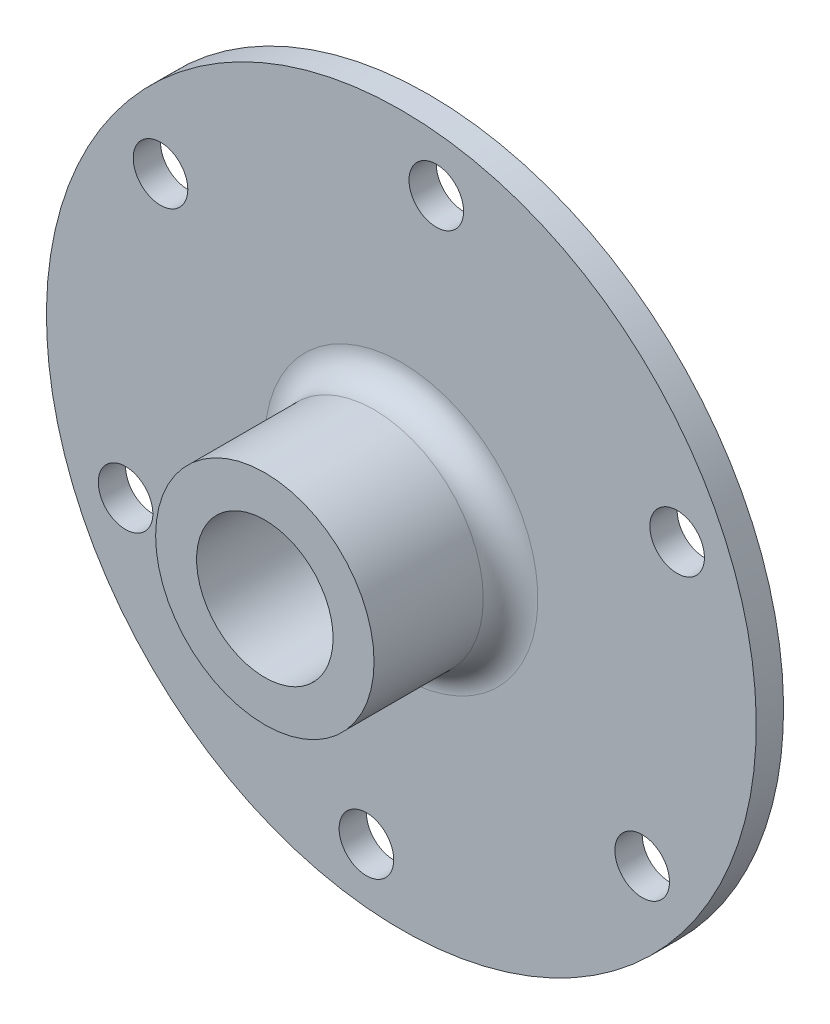
from build123d import *

# Parameters (mm, degrees)
SKETCH3_R          = 7.9375
SKETCH3_R_2        = 3.175
CUT_EXTRUDE1_DEPTH = 62.401577748
CIRPATTERN1_COUNT  = 6
FILLET1_R          = 3.175


with BuildPart() as part:
    # Sketch2 → Revolve1 (revolve)
    with BuildSketch(Plane(origin=(0, 0, 0), x_dir=(0, 0, -1), z_dir=(1, 0, 0))):
        Polygon((0, 0), (0, 41.275), (-3.175, 41.275), (-3.175, 12.7), (-19.05, 12.7), (-19.05, 0), align=None)
    revolve(axis=Axis((0, 0, 0), (0, 0, 1)))

    # Sketch3 → Cut-Extrude1 (cut, through all)
    with BuildSketch(Plane.XY.offset(19.05)):
        Circle(SKETCH3_R)
        with Locations((-28.008609796, 20.863206903)):
            Circle(SKETCH3_R_2)
    cut_extrude1 = extrude(amount=-CUT_EXTRUDE1_DEPTH, mode=Mode.SUBTRACT)

    # CirPattern1: Cut-Extrude1 ×6 about axis
    cirpattern1_axis = Axis((0, 0, 0), (0, 0, 1))
    for i in range(1, CIRPATTERN1_COUNT):
        add(cut_extrude1.rotate(cirpattern1_axis, i * 360 / CIRPATTERN1_COUNT), mode=Mode.SUBTRACT)

    # Fillet1
    fillet1_edges = [part.edges().sort_by_distance(p)[0] for p in [
        (0, -12.7, 3.175),
    ]]
    fillet(fillet1_edges, radius=FILLET1_R)


solid = part.part
